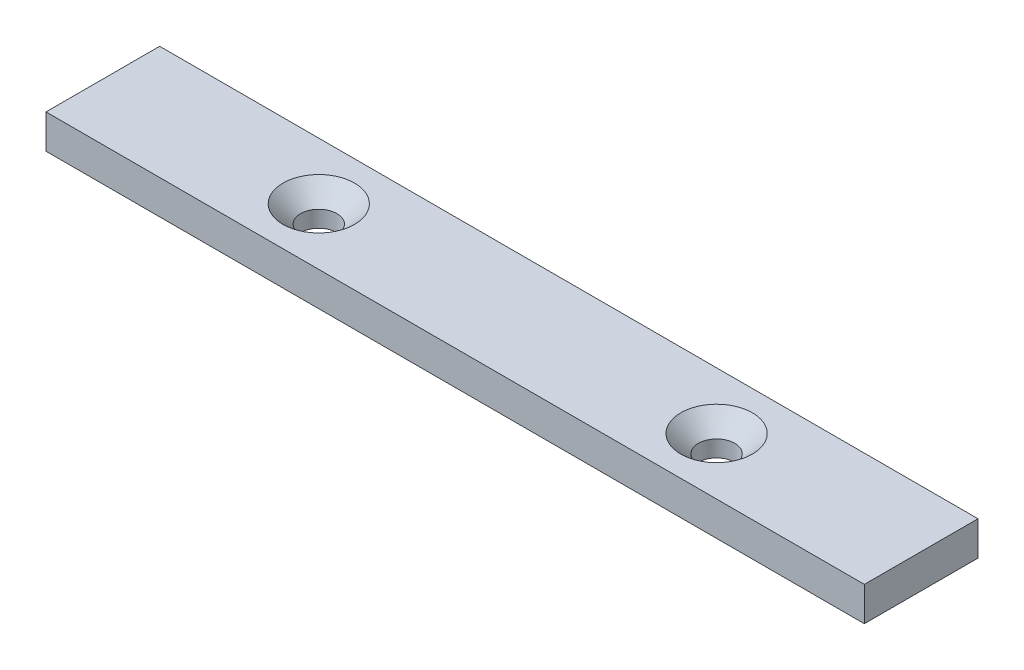
from build123d import *

# Parameters (mm, degrees)
SKETCH1_W                                      = 144
SKETCH1_H                                      = 20
BOSS_EXTRUDE1_DEPTH                            = 6
CSK_FOR_M6_FLAT_HEAD_MACHINE_SCREW1_AT_2_COUNT = 2
CSK_FOR_M6_FLAT_HEAD_MACHINE_SCREW1_AT_2_PITCH = 70


with BuildPart() as part:
    # Sketch1 → Boss-Extrude1 (new body)
    with BuildSketch(Plane(origin=(0, 0, 0), x_dir=(1, 0, 0), z_dir=(0, 1, 0))):
        Rectangle(SKETCH1_W, SKETCH1_H)
    extrude(amount=BOSS_EXTRUDE1_DEPTH)

    # Sketch3 → CSK for M6 Flat Head Machine Screw1 (revolve, cut)
    with BuildSketch(Plane(origin=(36, 6, 0), x_dir=(0, 0, 1), z_dir=(1, 0, 0))):
        Polygon((0, 0), (0, 6), (3.2, 6), (3.2, 3.1), (6.3, 0), align=None)
    csk_for_m6_flat_head_machine_screw1 = revolve(axis=Axis((36, 12.35, 0), (0, -1, 0)), mode=Mode.SUBTRACT)

    # CSK for M6 Flat Head Machine Screw1 at 2: CSK for M6 Flat Head Machine Screw1 ×2
    with Locations(*[(-i * CSK_FOR_M6_FLAT_HEAD_MACHINE_SCREW1_AT_2_PITCH, 0, 0) for i in range(1, CSK_FOR_M6_FLAT_HEAD_MACHINE_SCREW1_AT_2_COUNT)]):
        add(csk_for_m6_flat_head_machine_screw1, mode=Mode.SUBTRACT)


solid = part.part
